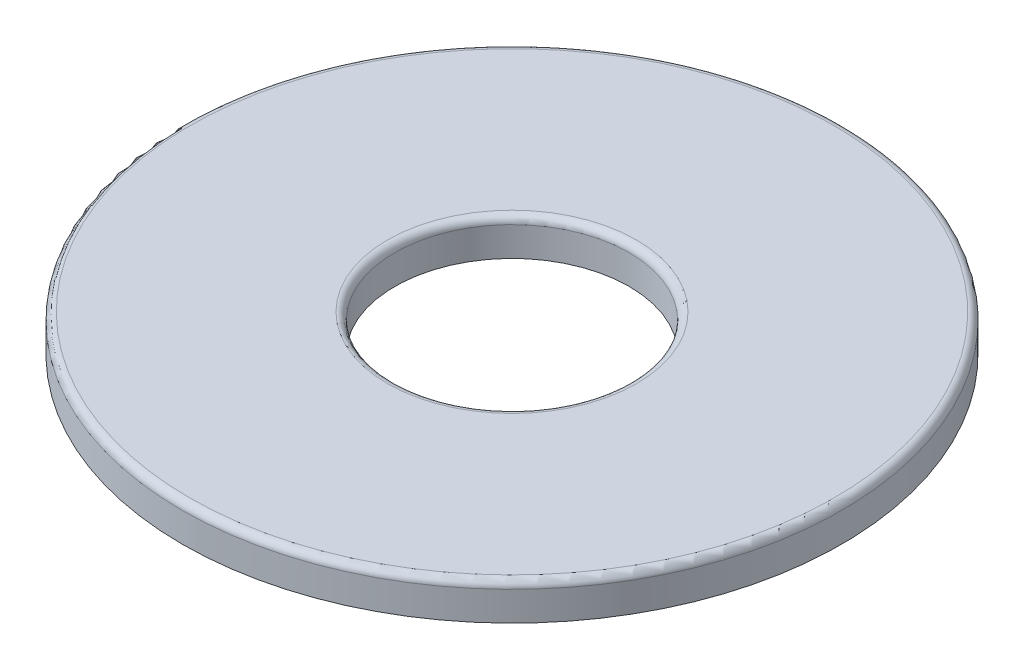
from build123d import *

# Parameters (mm, degrees)
SZKIC1_R                    = 4.5
SZKIC1_R_2                  = 1.6
DODANIE_WYCI_GNI_CIE1_DEPTH = 0.5
ZAOKR_GLENIE1_R             = 0.1


with BuildPart() as part:
    # Szkic1 → Dodanie-wyciągnięcie1 (new body)
    with BuildSketch(Plane(origin=(0, 0, 0), x_dir=(1, 0, 0), z_dir=(0, 1, 0))):
        with Locations(Location((0, 0, 0), (0, 0, 270))):
            Circle(SZKIC1_R)
        with Locations(Location((0, 0, 0), (0, 0, 270))):
            Circle(SZKIC1_R_2, mode=Mode.SUBTRACT)
    extrude(amount=DODANIE_WYCI_GNI_CIE1_DEPTH)

    # Zaokrąglenie1
    zaokr_glenie1_edges = [part.edges().sort_by_distance(p)[0] for p in [
        (0, 0.5, -4.5),
        (0, 0.5, -1.6),
    ]]
    fillet(zaokr_glenie1_edges, radius=ZAOKR_GLENIE1_R)


solid = part.part
